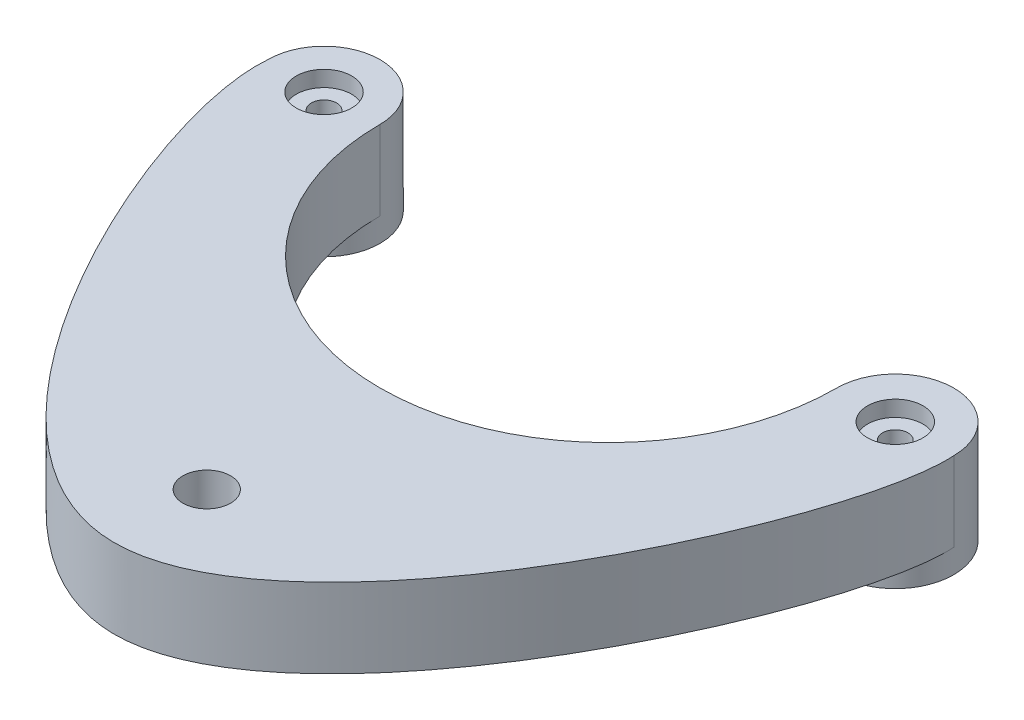
from build123d import *

# Parameters (mm, degrees)
SKETCH6_R             = 3.53339779
BOSS_EXTRUDE4_DEPTH   = 1.5
SKETCH6_R_2           = 3.688460373
BOSS_EXTRUDE4_2_DEPTH = 1.5
BOSS_EXTRUDE5_START   = 5
BOSS_EXTRUDE5_DEPTH   = 5
SKETCH12_R            = 0.8
CUT_EXTRUDE3_DEPTH    = 39.562588294
SKETCH13_R            = 1.75
SCREW_INSET_CUT_DEPTH = 1
CUT_EXTRUDE4_REACH    = 40.563
SKETCH15_R            = 1.5


with BuildPart() as part:
    # Sketch6 → Boss-Extrude4 (new body)
    with BuildSketch(Plane(origin=(0, 0, 0), x_dir=(1, 0, 0), z_dir=(0, 1, 0))):
        with Locations(Location((-18, 0, 0), (0, 0, 270))):
            Circle(SKETCH6_R)
    extrude(amount=-BOSS_EXTRUDE4_DEPTH)



with BuildPart() as body_2:
    # Sketch6 → Boss-Extrude4 2 (new body)
    with BuildSketch(Plane(origin=(0, 0, 0), x_dir=(1, 0, 0), z_dir=(0, 1, 0))):
        with Locations(Location((18, 0, 0), (0, 0, 270))):
            Circle(SKETCH6_R_2)
    extrude(amount=-BOSS_EXTRUDE4_2_DEPTH)


with BuildPart() as part_1:
    add(part.part)

    add(body_2.part)  # Boss-Extrude5 merges body 2
    # Sketch7 → Boss-Extrude5 (add)
    with BuildSketch(Plane(origin=(0, 0, 0), x_dir=(1, 0, 0), z_dir=(0, 1, 0)).offset(BOSS_EXTRUDE5_START)):
        with BuildLine():
            ThreePointArc((14.311539627, 0), (-0.077531291, -14.389070918), (-14.46660221, 0))
            ThreePointArc((-14.46660221, 0), (-18, 3.53339779), (-21.53339779, 0))
            add(Edge.make_bspline(
                [(-21.53339779, 0), (-22.195175759, -7.215488117), (0.037694985, -55.230023243), (22.180786806, -7.144108664), (21.688460373, 0)],
                knots=[0, 0, 0, 0, 0.49965634, 1, 1, 1, 1], degree=3))
            ThreePointArc((21.688460373, 0), (18, 3.688460373), (14.311539627, 0))
        make_face()
    extrude(amount=-BOSS_EXTRUDE5_DEPTH)

    # Sketch12 → Cut-Extrude3 (cut, through all)
    with BuildSketch(Plane(origin=(0, 5, 0), x_dir=(1, 0, 0), z_dir=(0, 1, 0))):
        with Locations(Location((-18, 0, 0), (0, 0, 270))):
            Circle(SKETCH12_R)
        with Locations(Location((18, 0, 0), (0, 0, 270))):
            Circle(SKETCH12_R)
    extrude(amount=-CUT_EXTRUDE3_DEPTH, mode=Mode.SUBTRACT)

    # Sketch13 → Screw Inset Cut (cut)
    with BuildSketch(Plane(origin=(0, 5, 0), x_dir=(1, 0, 0), z_dir=(0, 1, 0))):
        with Locations(Location((-18, 0, 0), (0, 0, 270))):
            Circle(SKETCH13_R)
        with Locations(Location((18, 0, 0), (0, 0, 270))):
            Circle(SKETCH13_R)
    extrude(amount=-SCREW_INSET_CUT_DEPTH, mode=Mode.SUBTRACT)

    # Sketch15 → Cut-Extrude4 (cut, up to next)
    with BuildSketch(Plane(origin=(0, 5, 0), x_dir=(1, 0, 0), z_dir=(0, 1, 0)), mode=Mode.PRIVATE) as cut_extrude4_sk1:
        with Locations(Location((0, -25.386616325, 0), (0, 0, 270))):
            Circle(SKETCH15_R)
    cut_extrude4_tool1 = extrude(cut_extrude4_sk1.sketch, amount=-CUT_EXTRUDE4_REACH, mode=Mode.PRIVATE) & part_1.part
    add(cut_extrude4_tool1.solids().sort_by_distance((0, 5, 25.386616))[0], mode=Mode.SUBTRACT)


solid = part_1.part
